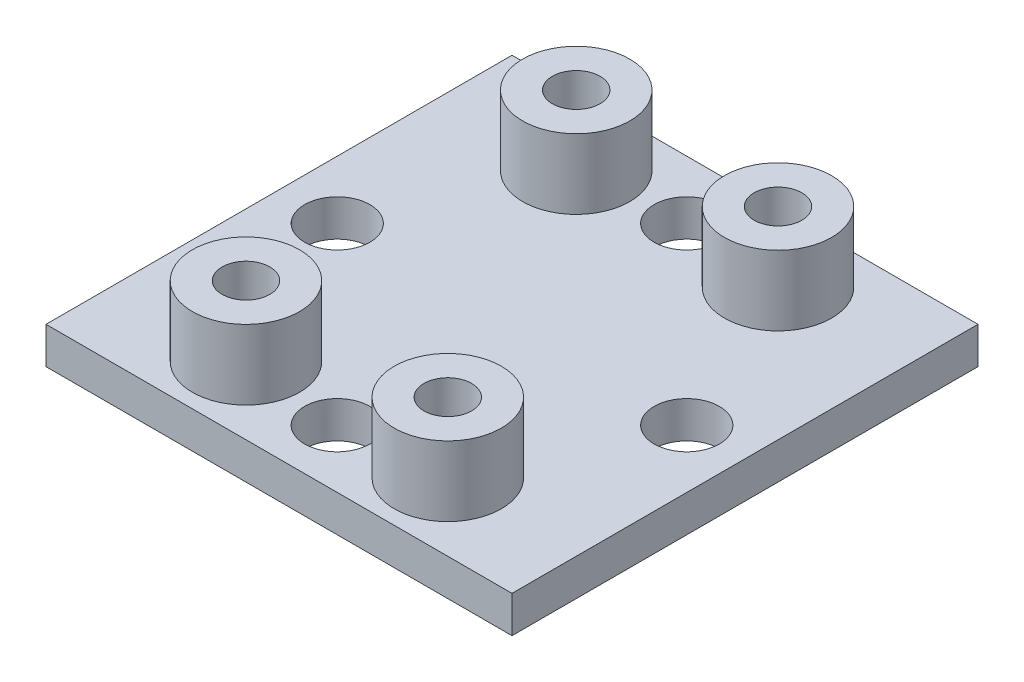
from build123d import *

# Parameters (mm, degrees)
SKETCH1_W           = 25.4
SKETCH1_H           = 25.4
BOSS_EXTRUDE1_DEPTH = 2
SKETCH4_R           = 1.778
CUT_EXTRUDE1_DEPTH  = 19.071524562
SKETCH3_R           = 2.921
SKETCH3_R_2         = 1.3
BOSS_EXTRUDE2_DEPTH = 3.81
CIRPATTERN2_COUNT   = 4


with BuildPart() as part:
    # Sketch1 → Boss-Extrude1 (new body)
    with BuildSketch(Plane(origin=(0, 0, 0), x_dir=(1, 0, 0), z_dir=(0, 1, 0))):
        Rectangle(SKETCH1_W, SKETCH1_H)
    extrude(amount=BOSS_EXTRUDE1_DEPTH)

    # Sketch4 → Cut-Extrude1 (cut, through all)
    with BuildSketch(Plane(origin=(0, 0, 0), x_dir=(1, 0, 0), z_dir=(0, 1, 0))):
        with Locations(Location((-9.525, 0, 0), (0, 0, 270))):
            Circle(SKETCH4_R)
    cut_extrude1 = extrude(amount=CUT_EXTRUDE1_DEPTH, mode=Mode.SUBTRACT)

    # Sketch3 → Boss-Extrude2 (add)
    # profile 1 of 4: a face of its own
    with BuildSketch(Plane(origin=(0, 2, 0), x_dir=(1, 0, 0), z_dir=(0, 1, 0))):
        with Locations(Location((-5.5, 9, 0), (0, 0, 90))):
            Circle(SKETCH3_R)
        with Locations(Location((-5.5, 9, 0), (0, 0, 90))):
            Circle(SKETCH3_R_2, mode=Mode.SUBTRACT)
    # profile 2 of 4: a face of its own
    with BuildSketch(Plane(origin=(0, 2, 0), x_dir=(1, 0, 0), z_dir=(0, 1, 0))):
        with Locations(Location((5.5, 9, 0), (0, 0, 90))):
            Circle(SKETCH3_R)
        with Locations(Location((5.5, 9, 0), (0, 0, 90))):
            Circle(SKETCH3_R_2, mode=Mode.SUBTRACT)
    # profile 3 of 4: a face of its own
    with BuildSketch(Plane(origin=(0, 2, 0), x_dir=(1, 0, 0), z_dir=(0, 1, 0))):
        with Locations(Location((5.5, -9, 0), (0, 0, 90))):
            Circle(SKETCH3_R)
        with Locations(Location((5.5, -9, 0), (0, 0, 90))):
            Circle(SKETCH3_R_2, mode=Mode.SUBTRACT)
    # profile 4 of 4: a face of its own
    with BuildSketch(Plane(origin=(0, 2, 0), x_dir=(1, 0, 0), z_dir=(0, 1, 0))):
        with Locations(Location((-5.5, -9, 0), (0, 0, 90))):
            Circle(SKETCH3_R)
        with Locations(Location((-5.5, -9, 0), (0, 0, 90))):
            Circle(SKETCH3_R_2, mode=Mode.SUBTRACT)
    extrude(amount=BOSS_EXTRUDE2_DEPTH)

    # CirPattern2: Cut-Extrude1 ×4 about axis
    cirpattern2_axis = Axis((0, 0, 0), (0, 1, 0))
    for i in range(1, CIRPATTERN2_COUNT):
        add(cut_extrude1.rotate(cirpattern2_axis, i * 360 / CIRPATTERN2_COUNT), mode=Mode.SUBTRACT)


solid = part.part
